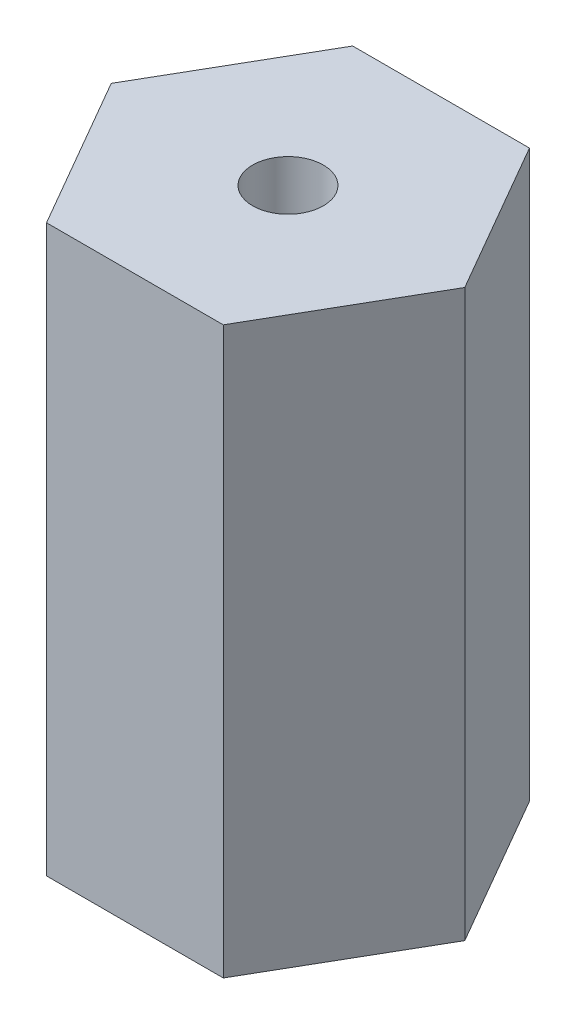
from build123d import *

# Parameters (mm, degrees)
SKETCH1_R           = 1
BOSS_EXTRUDE2_DEPTH = 16


with BuildPart() as part:
    # Sketch1 → Boss-Extrude2 (new body)
    with BuildSketch(Plane(origin=(0, 0, 0), x_dir=(1, 0, 0), z_dir=(0, 1, 0))):
        Polygon((5, 0), (2.5, 4.330127019), (-2.5, 4.330127019), (-5, 0), (-2.5, -4.330127019), (2.5, -4.330127019), align=None)
        with Locations(Location((0, 0, 0), (0, 0, 270))):
            Circle(SKETCH1_R, mode=Mode.SUBTRACT)
    extrude(amount=BOSS_EXTRUDE2_DEPTH)


solid = part.part
